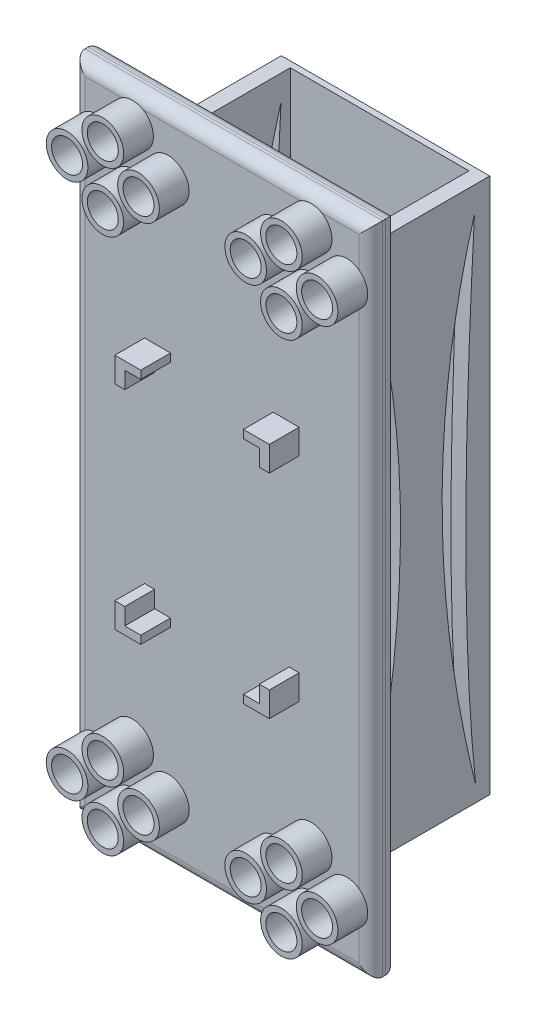
from build123d import *

# Parameters (mm, degrees)
CROQUIS1_W              = 50
CROQUIS1_H              = 110
SALIENTE_EXTRUIR1_DEPTH = 4.5
REDONDEO1_R             = 2
CROQUIS2_R              = 3.5
CROQUIS2_R_2            = 2.6
SALIENTE_EXTRUIR2_DEPTH = 5
CROQUIS3_W              = 35
CROQUIS3_H              = 90
SALIENTE_EXTRUIR3_DEPTH = 23
CROQUIS5_W              = 30
CROQUIS5_H              = 21
CORTAR_EXTRUIR2_DEPTH   = 106.61249926
CORTAR_EXTRUIR5_DEPTH   = 74.213728221
SALIENTE_EXTRUIR4_DEPTH = 5


with BuildPart() as part:
    # Croquis1 → Saliente-Extruir1 (new body)
    with BuildSketch(Plane.XY):
        Rectangle(CROQUIS1_W, CROQUIS1_H)
    extrude(amount=SALIENTE_EXTRUIR1_DEPTH)

    # Redondeo1
    redondeo1_edges = [part.edges().sort_by_distance(p)[0] for p in [
        (0, 55, 0),
        (0, 55, 4.5),
        (-25, 0, 0),
        (-25, 0, 4.5),
        (0, -55, 0),
        (0, -55, 4.5),
        (25, 0, 0),
        (25, 0, 4.5),
    ]]
    fillet(redondeo1_edges, radius=REDONDEO1_R)

    # Croquis2 → Saliente-Extruir2 (add)
    # profile 1 of 16: a face of its own
    with BuildSketch(Plane.XY.offset(4.5)):
        with Locations((-15, 50)):
            Circle(CROQUIS2_R)
        with Locations((-15, 50)):
            Circle(CROQUIS2_R_2, mode=Mode.SUBTRACT)
    # profile 2 of 16: a face of its own
    with BuildSketch(Plane.XY.offset(4.5)):
        with Locations((-15, 40)):
            Circle(CROQUIS2_R)
        with Locations((-15, 40)):
            Circle(CROQUIS2_R_2, mode=Mode.SUBTRACT)
    # profile 3 of 16: a face of its own
    with BuildSketch(Plane.XY.offset(4.5)):
        with Locations((-9, 45)):
            Circle(CROQUIS2_R)
        with Locations((-9, 45)):
            Circle(CROQUIS2_R_2, mode=Mode.SUBTRACT)
    # profile 4 of 16: a face of its own
    with BuildSketch(Plane.XY.offset(4.5)):
        with Locations((-21, 45)):
            Circle(CROQUIS2_R)
        with Locations((-21, 45)):
            Circle(CROQUIS2_R_2, mode=Mode.SUBTRACT)
    # profile 5 of 16: a face of its own
    with BuildSketch(Plane.XY.offset(4.5)):
        with Locations((21, 45)):
            Circle(CROQUIS2_R)
        with Locations((21, 45)):
            Circle(CROQUIS2_R_2, mode=Mode.SUBTRACT)
    # profile 6 of 16: a face of its own
    with BuildSketch(Plane.XY.offset(4.5)):
        with Locations((15, 40)):
            Circle(CROQUIS2_R)
        with Locations((15, 40)):
            Circle(CROQUIS2_R_2, mode=Mode.SUBTRACT)
    # profile 7 of 16: a face of its own
    with BuildSketch(Plane.XY.offset(4.5)):
        with Locations((9, 45)):
            Circle(CROQUIS2_R)
        with Locations((9, 45)):
            Circle(CROQUIS2_R_2, mode=Mode.SUBTRACT)
    # profile 8 of 16: a face of its own
    with BuildSketch(Plane.XY.offset(4.5)):
        with Locations((15, 50)):
            Circle(CROQUIS2_R)
        with Locations((15, 50)):
            Circle(CROQUIS2_R_2, mode=Mode.SUBTRACT)
    # profile 9 of 16: a face of its own
    with BuildSketch(Plane.XY.offset(4.5)):
        with Locations((15, -40)):
            Circle(CROQUIS2_R)
        with Locations((15, -40)):
            Circle(CROQUIS2_R_2, mode=Mode.SUBTRACT)
    # profile 10 of 16: a face of its own
    with BuildSketch(Plane.XY.offset(4.5)):
        with Locations((21, -45)):
            Circle(CROQUIS2_R)
        with Locations((21, -45)):
            Circle(CROQUIS2_R_2, mode=Mode.SUBTRACT)
    # profile 11 of 16: a face of its own
    with BuildSketch(Plane.XY.offset(4.5)):
        with Locations((9, -45)):
            Circle(CROQUIS2_R)
        with Locations((9, -45)):
            Circle(CROQUIS2_R_2, mode=Mode.SUBTRACT)
    # profile 12 of 16: a face of its own
    with BuildSketch(Plane.XY.offset(4.5)):
        with Locations((15, -50)):
            Circle(CROQUIS2_R)
        with Locations((15, -50)):
            Circle(CROQUIS2_R_2, mode=Mode.SUBTRACT)
    # profile 13 of 16: a face of its own
    with BuildSketch(Plane.XY.offset(4.5)):
        with Locations((-15, -40)):
            Circle(CROQUIS2_R)
        with Locations((-15, -40)):
            Circle(CROQUIS2_R_2, mode=Mode.SUBTRACT)
    # profile 14 of 16: a face of its own
    with BuildSketch(Plane.XY.offset(4.5)):
        with Locations((-9, -45)):
            Circle(CROQUIS2_R)
        with Locations((-9, -45)):
            Circle(CROQUIS2_R_2, mode=Mode.SUBTRACT)
    # profile 15 of 16: a face of its own
    with BuildSketch(Plane.XY.offset(4.5)):
        with Locations((-21, -45)):
            Circle(CROQUIS2_R)
        with Locations((-21, -45)):
            Circle(CROQUIS2_R_2, mode=Mode.SUBTRACT)
    # profile 16 of 16: a face of its own
    with BuildSketch(Plane.XY.offset(4.5)):
        with Locations((-15, -50)):
            Circle(CROQUIS2_R)
        with Locations((-15, -50)):
            Circle(CROQUIS2_R_2, mode=Mode.SUBTRACT)
    extrude(amount=SALIENTE_EXTRUIR2_DEPTH)

    # Croquis3 → Saliente-Extruir3 (add)
    with BuildSketch(Plane(origin=(0, 0, 0), x_dir=(-1, 0, 0), z_dir=(0, 0, -1))):
        Rectangle(CROQUIS3_W, CROQUIS3_H)
    extrude(amount=SALIENTE_EXTRUIR3_DEPTH)

    # Croquis5 → Cortar-Extruir2 (cut, through all)
    with BuildSketch(Plane(origin=(0, 45, 0), x_dir=(1, 0, 0), z_dir=(0, 1, 0))):
        with Locations((0, 11.5)):
            Rectangle(CROQUIS5_W, CROQUIS5_H)
    extrude(amount=-CORTAR_EXTRUIR2_DEPTH, mode=Mode.SUBTRACT)

    # Croquis8 → Cortar-Extruir5 (cut, through all)
    with BuildSketch(Plane(origin=(17.5, 0, 0), x_dir=(0, 0, -1), z_dir=(1, 0, 0))):
        with BuildLine():
            add(Edge.make_bspline(
                [(2.569348743, 40.716245485), (9.080503754, 18.53762373), (10.580801765, -9.48585487), (2.377628668, -42.298547258)],
                knots=[0, 0, 0, 0, 1, 1, 1, 1], degree=3))
            add(Edge.make_bspline(
                [(2.377628668, -42.298547258), (5.133604453, -15.937039747), (3.893375388, 16.552759214), (2.569348743, 40.716245485)],
                knots=[0, 0, 0, 0, 1, 1, 1, 1], degree=3))
        make_face()
        with BuildLine():
            add(Edge.make_bspline(
                [(20.430651257, 40.716245485), (13.919496246, 18.53762373), (12.419198235, -9.48585487), (20.622371332, -42.298547258)],
                knots=[0, 0, 0, 0, 1, 1, 1, 1], degree=3))
            add(Edge.make_bspline(
                [(20.622371332, -42.298547258), (17.866395547, -15.937039747), (19.106624612, 16.552759214), (20.430651257, 40.716245485)],
                knots=[0, 0, 0, 0, 1, 1, 1, 1], degree=3))
        make_face()
    extrude(amount=-CORTAR_EXTRUIR5_DEPTH, mode=Mode.SUBTRACT)

    # Croquis9 → Saliente-Extruir4 (add)
    with BuildSketch(Plane.XY.offset(4.5)):
        Polygon((-11.3, 15.774008449), (-11.3, 18.6), (-8.618398116, 18.6), (-8.618398116, 19.949759238), (-12.981572725, 19.949759238), (-12.981572725, 15.774008449), align=None)
        Polygon((-8.618398116, -18.6), (-11.3, -18.6), (-11.3, -15.774008449), (-12.981572725, -15.774008449), (-12.981572725, -19.949759238), (-8.618398116, -19.949759238), align=None)
        Polygon((8.618398116, 18.6), (11.3, 18.6), (11.3, 15.774008449), (12.981572725, 15.774008449), (12.981572725, 19.949759238), (8.618398116, 19.949759238), align=None)
        Polygon((11.3, -18.6), (8.618398116, -18.6), (8.618398116, -19.949759238), (12.981572725, -19.949759238), (12.981572725, -15.774008449), (11.3, -15.774008449), align=None)
    extrude(amount=SALIENTE_EXTRUIR4_DEPTH)


solid = part.part
